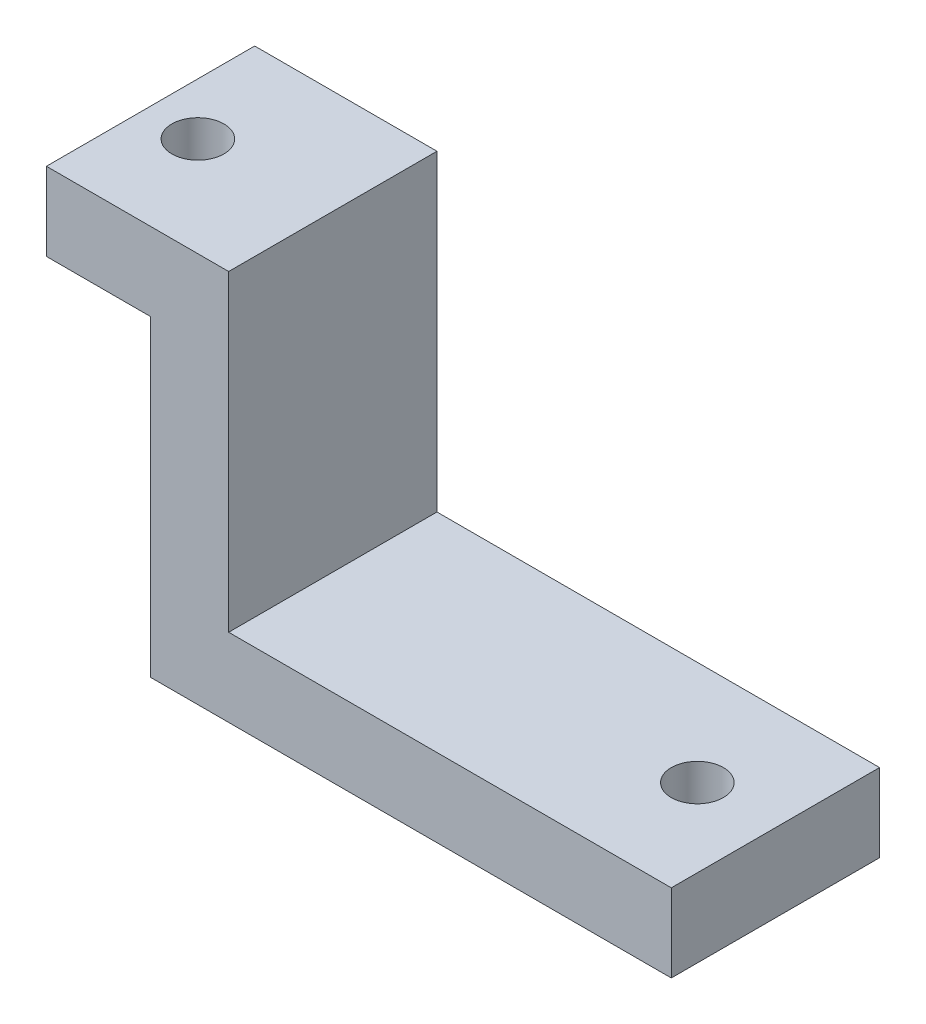
from build123d import *

# Parameters (mm, degrees)
SKETCH1_W           = 8
SKETCH1_H           = 15
BOSS_EXTRUDE1_DEPTH = 3
SKETCH2_W           = 17
SKETCH2_H           = 8
SKETCH2_R           = 1
BOSS_EXTRUDE2_DEPTH = 3
SKETCH3_W           = 4
SKETCH3_H           = 8
SKETCH3_R           = 1
BOSS_EXTRUDE3_DEPTH = 3


with BuildPart() as part:
    # Sketch1 → Boss-Extrude1 (new body)
    with BuildSketch(Plane(origin=(0, 0, 0), x_dir=(0, 0, -1), z_dir=(1, 0, 0))):
        with Locations((4, 7.5)):
            Rectangle(SKETCH1_W, SKETCH1_H)
    extrude(amount=BOSS_EXTRUDE1_DEPTH)

    # Sketch2 → Boss-Extrude2 (add)
    with BuildSketch(Plane(origin=(0, 0, 0), x_dir=(1, 0, 0), z_dir=(0, 1, 0))):
        with Locations((11.5, 4)):
            Rectangle(SKETCH2_W, SKETCH2_H)
        with Locations(Location((17, 4, 0), (0, 0, 270))):
            Circle(SKETCH2_R, mode=Mode.SUBTRACT)
    extrude(amount=BOSS_EXTRUDE2_DEPTH)

    # Sketch3 → Boss-Extrude3 (add)
    with BuildSketch(Plane(origin=(0, 15, 0), x_dir=(1, 0, 0), z_dir=(0, 1, 0))):
        with Locations((-2, 4)):
            Rectangle(SKETCH3_W, SKETCH3_H)
        with Locations(Location((-2, 3.81772143, 0), (0, 0, 270))):
            Circle(SKETCH3_R, mode=Mode.SUBTRACT)
    extrude(amount=-BOSS_EXTRUDE3_DEPTH)


solid = part.part
